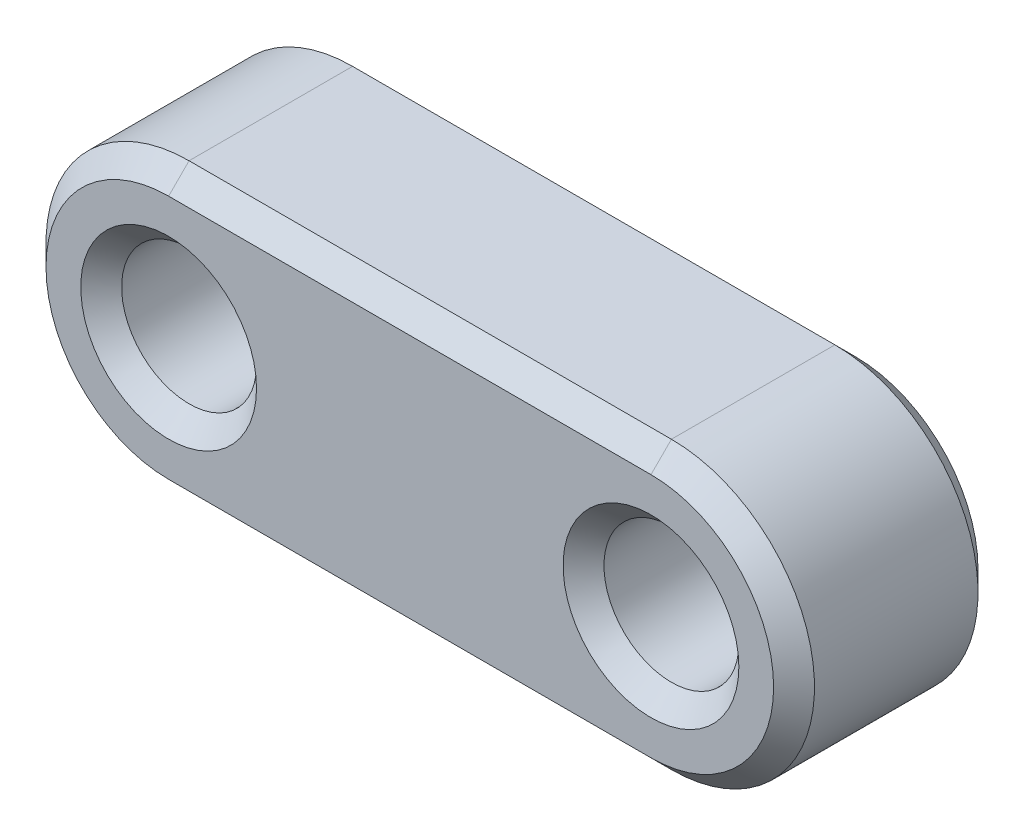
from build123d import *

# Parameters (mm, degrees)
SKETCH_1_R      = 1.65
EXTRUDE_1_DEPTH = 5
CHAMFER_1_SIZE  = 0.5


with BuildPart() as part:
    # 草图1 → 凸台-拉伸1 (new body)
    with BuildSketch(Plane.XY):
        with BuildLine():
            Line((-5.9, 3.5), (5.9, 3.5))
            ThreePointArc((5.9, 3.5), (9.4, 0), (5.9, -3.5))
            Line((5.9, -3.5), (-5.9, -3.5))
            ThreePointArc((-5.9, -3.5), (-9.4, 0), (-5.9, 3.5))
        make_face()
        with Locations((5.9, 0)):
            Circle(SKETCH_1_R, mode=Mode.SUBTRACT)
        with Locations((-5.9, 0)):
            Circle(SKETCH_1_R, mode=Mode.SUBTRACT)
    extrude(amount=EXTRUDE_1_DEPTH)

    # 倒角1
    chamfer_1_edges = [part.edges().sort_by_distance(p)[0] for p in [
        (4.25, 0, 0),
        (4.25, 0, 5),
        (9.4, 0, 5),
        (-7.55, 0, 0),
        (-7.55, 0, 5),
        (0, 3.5, 5),
        (-9.4, 0, 5),
        (0, 3.5, 0),
        (9.4, 0, 0),
        (0, -3.5, 0),
        (-9.4, 0, 0),
        (0, -3.5, 5),
    ]]
    chamfer(chamfer_1_edges, length=CHAMFER_1_SIZE)


solid = part.part
